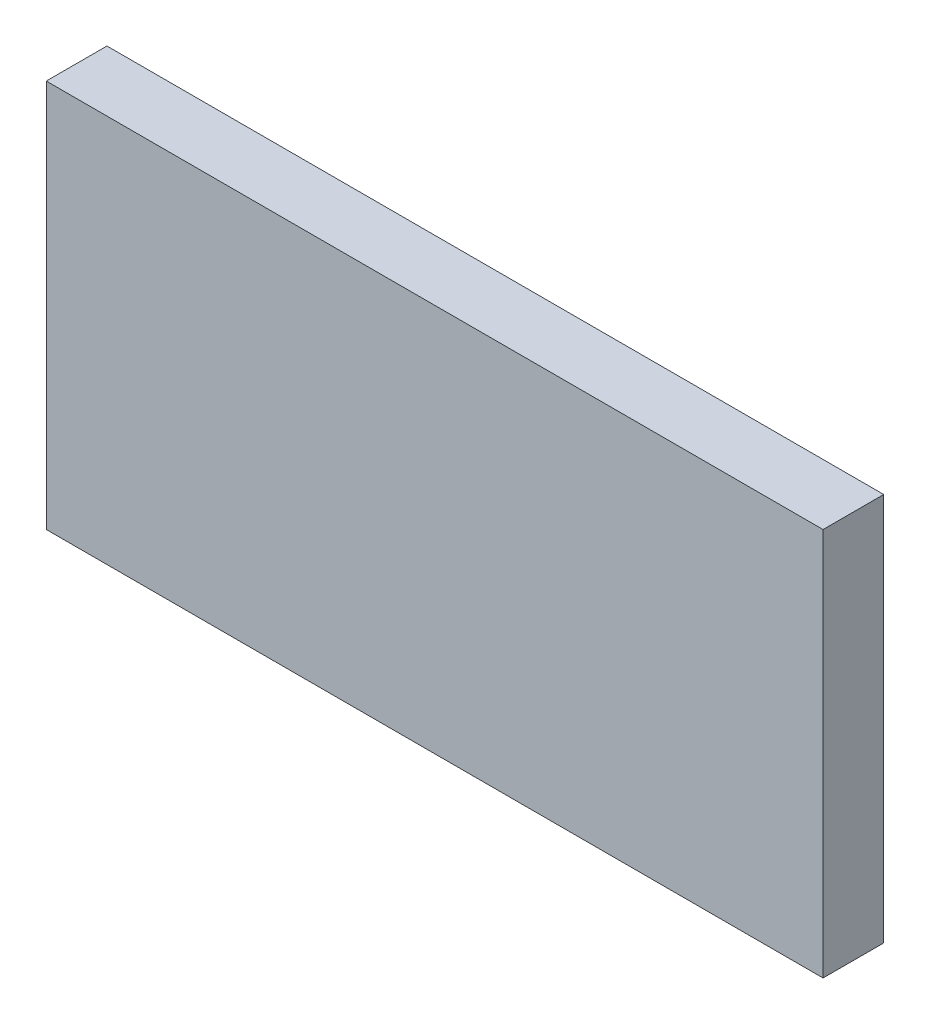
from build123d import *

# Parameters (mm, degrees)
SKETCH12_W          = 64
SKETCH12_H          = 32
BOSS_EXTRUDE1_DEPTH = 5


with BuildPart() as part:
    # Sketch12 → Boss-Extrude1 (new body)
    with BuildSketch(Plane.XY):
        Rectangle(SKETCH12_W, SKETCH12_H)
    extrude(amount=BOSS_EXTRUDE1_DEPTH)


solid = part.part
